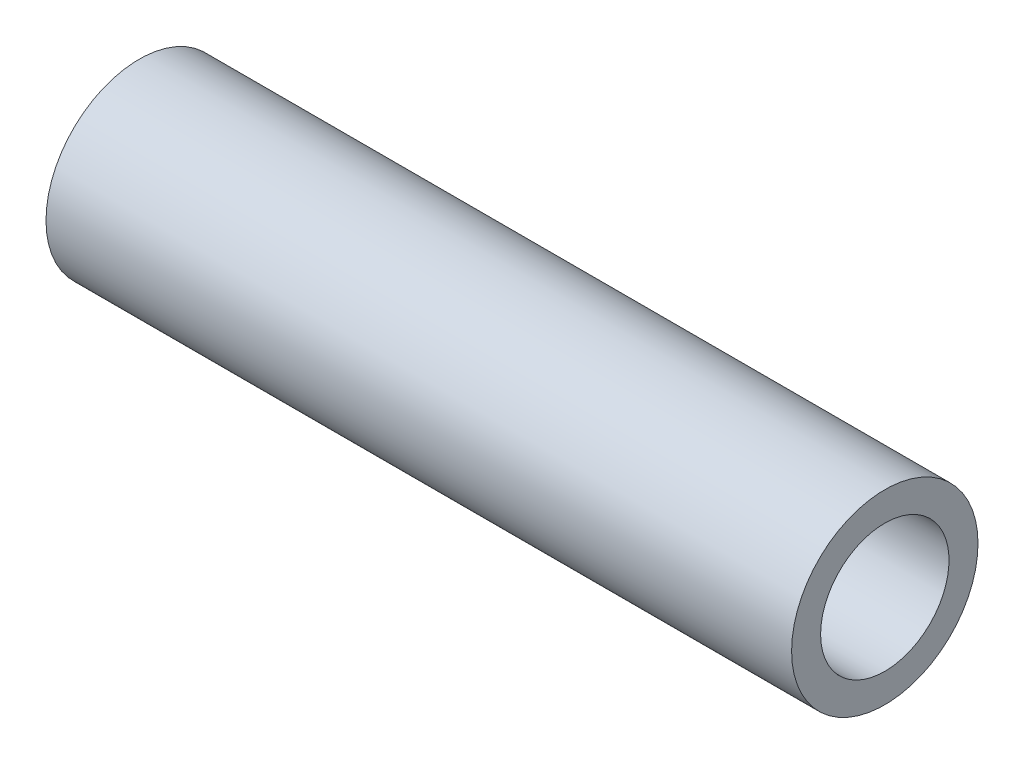
from build123d import *

# Parameters (mm, degrees)
SKETCH1_W = 18
SKETCH1_H = 0.7


with BuildPart() as part:
    # Sketch1 → Revolve1 (revolve)
    with BuildSketch(Plane.XY, mode=Mode.PRIVATE) as revolve1_sk:
        with Locations((9, 1.9)):
            Rectangle(SKETCH1_W, SKETCH1_H)
    revolve(revolve1_sk.sketch.rotate(Axis((0, 0, 0), (1, 0, 0)), 90), axis=Axis((0, 0, 0), (1, 0, 0)))


solid = part.part
